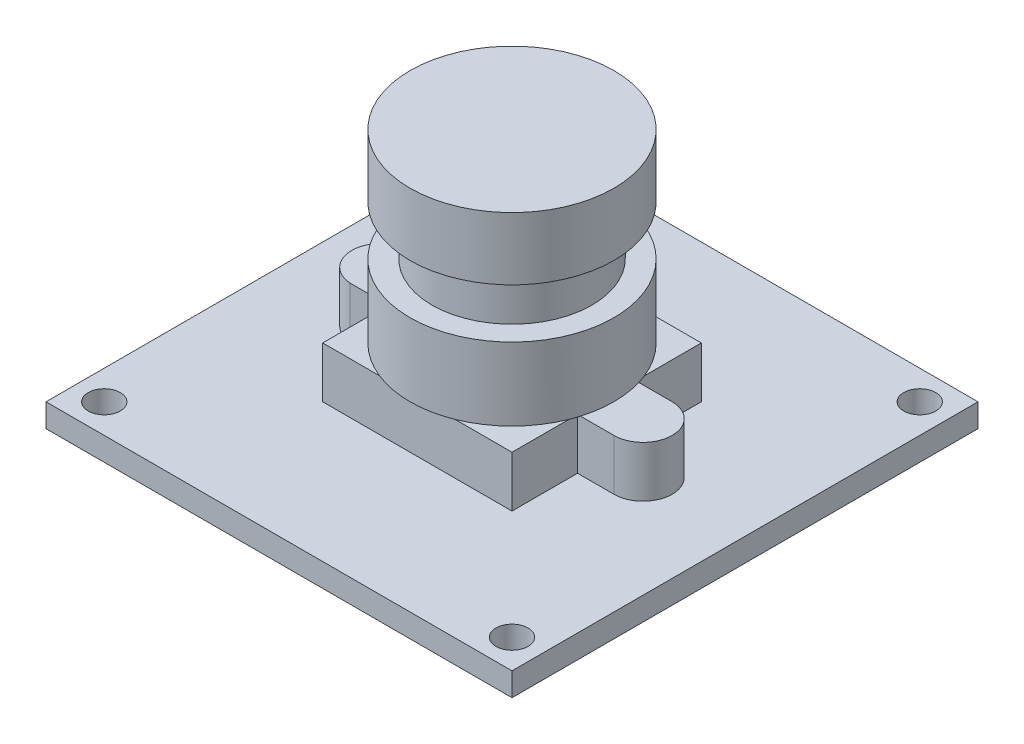
from build123d import *

# Parameters (mm, degrees)
SKETCH_1_W         = 32
SKETCH_1_H         = 32
EXTRUDE_1_DEPTH    = 1.6
HOLE_WIZARD_M2_1_D = 2.2
SKETCH_4_W         = 10
SKETCH_4_H         = 4.7
EXTRUDE_2_DEPTH    = 1.7
EXTRUDE_4_DEPTH    = 3.5
SKETCH_7_R         = 7
EXTRUDE_5_DEPTH    = 5
SKETCH_8_R         = 5.5
EXTRUDE_6_DEPTH    = 3.4
SKETCH_9_R         = 7
EXTRUDE_7_DEPTH    = 4.3


with BuildPart() as part:
    # 草图1 → 凸台-拉伸1 (new body)
    with BuildSketch(Plane(origin=(0, 0, 0), x_dir=(1, 0, 0), z_dir=(0, 1, 0))):
        Rectangle(SKETCH_1_W, SKETCH_1_H)
    extrude(amount=EXTRUDE_1_DEPTH)

    # M2 间隙孔1 (through all)
    with Locations(Plane(origin=(0, 1.6, 0), x_dir=(1, 0, 0), z_dir=(0, 1, 0))):
        with Locations((-14, 14), (14, 14), (14, -14), (-14, -14)):
            Hole(HOLE_WIZARD_M2_1_D / 2)

    # 草图4 → 凸台-拉伸2 (add)
    with BuildSketch(Plane(origin=(0, 0, 0), x_dir=(1, 0, 0), z_dir=(0, 1, 0))):
        with Locations((0, 12.73)):
            Rectangle(SKETCH_4_W, SKETCH_4_H)
    extrude(amount=-EXTRUDE_2_DEPTH)

    # 草图6 → 凸台-拉伸4 (add)
    with BuildSketch(Plane(origin=(0, 1.6, 0), x_dir=(1, 0, 0), z_dir=(0, 1, 0))):
        with BuildLine():
            Line((-6.5, 6.5), (6.5, 6.5))
            Line((6.5, 6.5), (6.5, 2))
            Line((6.5, 2), (9, 2))
            ThreePointArc((9, 2), (11, 0), (9, -2))
            Line((9, -2), (6.5, -2))
            Line((6.5, -2), (6.5, -6.5))
            Line((6.5, -6.5), (-6.5, -6.5))
            Line((-6.5, -6.5), (-6.5, -2))
            Line((-6.5, -2), (-9.119024186, -2))
            ThreePointArc((-9.119024186, -2), (-11.003538559, 0), (-9.119024186, 2))
            Line((-9.119024186, 2), (-6.5, 2))
            Line((-6.5, 2), (-6.5, 6.5))
        make_face()
    extrude(amount=EXTRUDE_4_DEPTH)

    # 草图7 → 凸台-拉伸5 (add)
    with BuildSketch(Plane(origin=(0, 5.1, 0), x_dir=(1, 0, 0), z_dir=(0, 1, 0))):
        with Locations(Location((-0.001769279, 0, 0), (0, 0, 68.213210702))):
            Circle(SKETCH_7_R)
    extrude(amount=EXTRUDE_5_DEPTH)

    # 草图8 → 凸台-拉伸6 (add)
    with BuildSketch(Plane(origin=(0, 10.1, 0), x_dir=(1, 0, 0), z_dir=(0, 1, 0))):
        with Locations(Location((0, 0, 0), (0, 0, 270))):
            Circle(SKETCH_8_R)
    extrude(amount=EXTRUDE_6_DEPTH)

    # 草图9 → 凸台-拉伸7 (add)
    with BuildSketch(Plane(origin=(0, 13.5, 0), x_dir=(1, 0, 0), z_dir=(0, 1, 0))):
        with Locations(Location((0, 0, 0), (0, 0, 90))):
            Circle(SKETCH_9_R)
    extrude(amount=EXTRUDE_7_DEPTH)


solid = part.part
